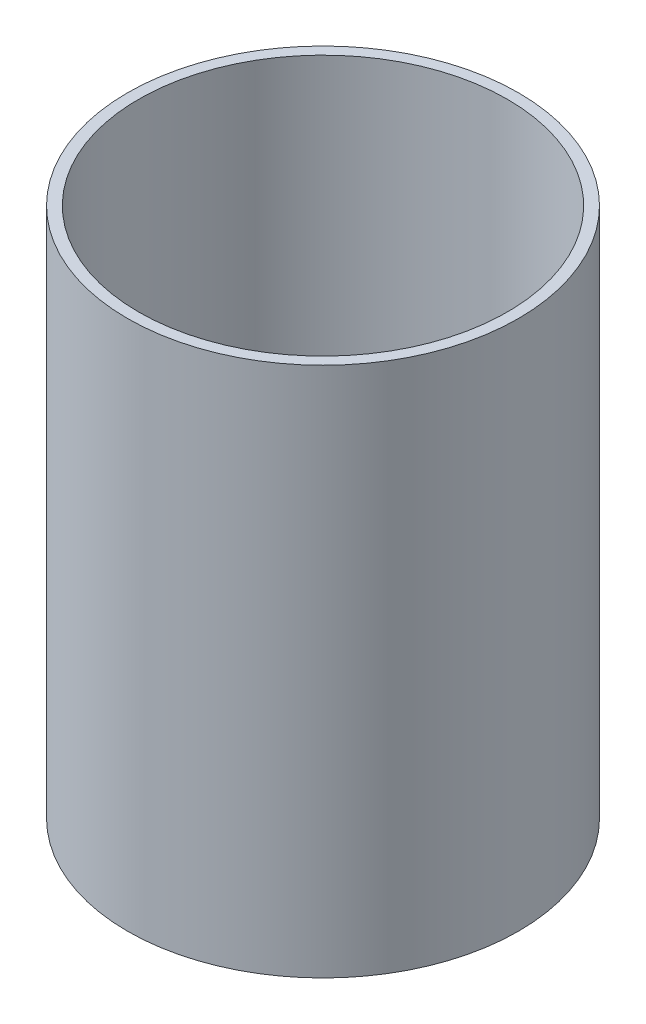
from build123d import *


with BuildPart() as part:
    # Croquis1 → Revolución1 (revolve)
    with BuildSketch(Plane.XY, mode=Mode.PRIVATE) as revoluci_n1_sk:
        Polygon((0, 0), (35, 0), (35, 95), (33, 95), (33, 2), (0, 2), align=None)
    revolve(revoluci_n1_sk.sketch.rotate(Axis((0, 25.616493672, 0), (0, -1, 0)), 90), axis=Axis((0, 25.616493672, 0), (0, -1, 0)))


solid = part.part
